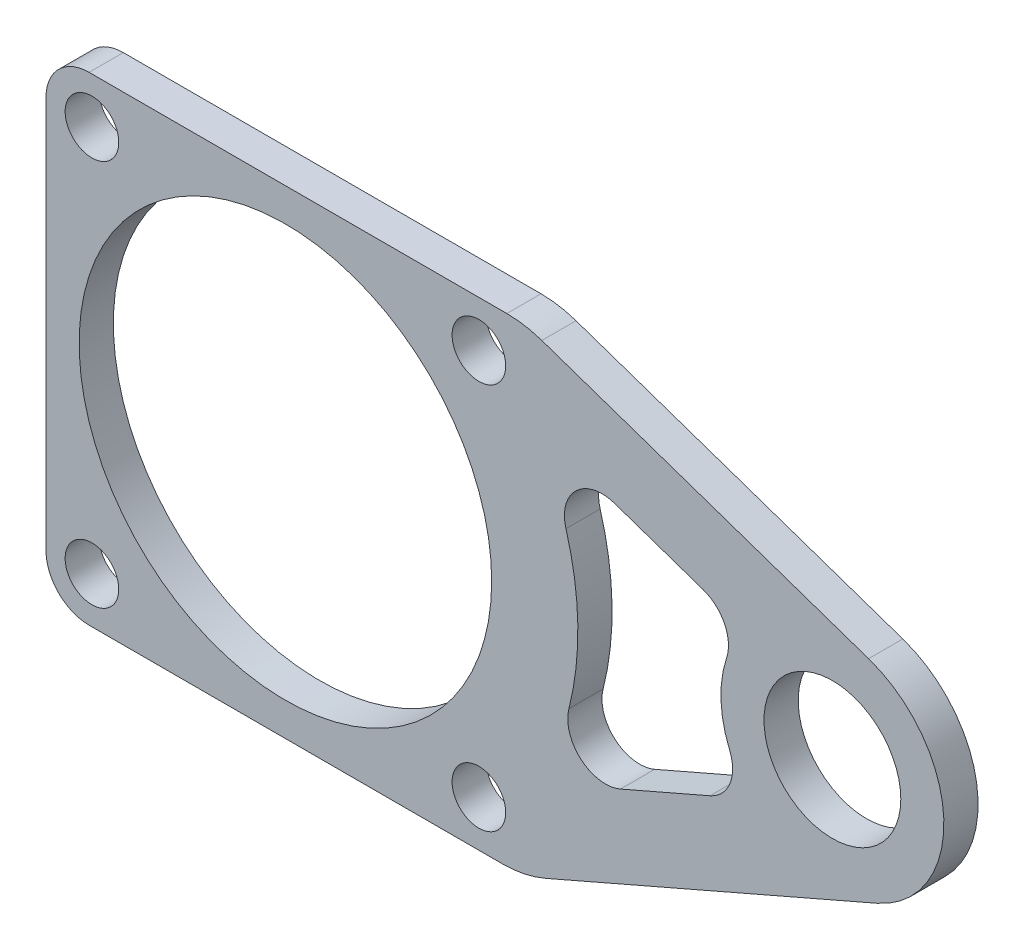
from build123d import *
from OCP.BRepFilletAPI import BRepFilletAPI_MakeFillet

# Parameters (mm, degrees)
SKETCH1_R              = 19.15
SKETCH1_R_2            = 6.35
BOSS_EXTRUDE1_DEPTH    = 3.175
F_10_CLEARANCE_HOLE1_D = 4.9784
FILLET1_R1             = 4
FILLET1_R2             = 10
CUT_EXTRUDE1_DEPTH     = 66.12085781
FILLET2_R              = 3.5


with BuildPart() as part:
    # Sketch1 → Boss-Extrude1 (new body)
    with BuildSketch(Plane.XY):
        with BuildLine():
            Line((54.139758885, 11.266432616), (22.225, 22.225))
            Line((22.225, 22.225), (-22.225, 22.225))
            Line((-22.225, 22.225), (-22.225, -22.225))
            Line((-22.225, -22.225), (22.225, -22.225))
            Line((22.225, -22.225), (54.905795434, -8.01403813))
            ThreePointArc((54.905795434, -8.01403813), (61.120351683, 1.888326902), (54.139758885, 11.266432616))
        make_face()
        Circle(SKETCH1_R, mode=Mode.SUBTRACT)
        with Locations((50.778511122, 1.477433)):
            Circle(SKETCH1_R_2, mode=Mode.SUBTRACT)
    extrude(amount=BOSS_EXTRUDE1_DEPTH)

    # #10 Clearance Hole1 (through all)
    with Locations(Plane.XY.offset(3.175)):
        with Locations((-17.960512242, 17.960512242), (17.960512242, 17.960512242), (17.960512242, -17.960512242), (-17.960512242, -17.960512242)):
            Hole(F_10_CLEARANCE_HOLE1_D / 2)

    # Fillet1: one fillet with a radius per group of edges: ONE call of the kernel's fillet builder (fillet() takes one radius for all edges)
    fillet1_edges_1 = [part.edges().sort_by_distance(p)[0] for p in [
        (-22.225, 22.225, 1.5875),
        (-22.225, -22.225, 1.5875),
    ]]
    fillet1_edges_2 = [part.edges().sort_by_distance(p)[0] for p in [
        (22.225, 22.225, 1.5875),
        (22.225, -22.225, 1.5875),
    ]]
    fillet1 = BRepFilletAPI_MakeFillet(part.part.solid().wrapped)
    for e in fillet1_edges_1:
        fillet1.Add(FILLET1_R1, e.wrapped)
    for e in fillet1_edges_2:
        fillet1.Add(FILLET1_R2, e.wrapped)
    add(Compound.cast(fillet1.Shape()), mode=Mode.REPLACE)

    # Sketch5 → Cut-Extrude1 (cut, through all)
    with BuildSketch(Plane.XY.offset(3.175)):
        with BuildLine():
            ThreePointArc((27.15, 0), (26.129764539, -7.37278137), (23.145734428, -14.191457916))
            Line((23.145734428, -14.191457916), (43.133854728, -5.499796294))
            ThreePointArc((43.133854728, -5.499796294), (40.43667056, 1.066539098), (42.604398146, 7.82616335))
            Line((42.604398146, 7.82616335), (22.893969402, 14.594131184))
            ThreePointArc((22.893969402, 14.594131184), (26.064283697, 7.601027257), (27.15, 0))
        make_face()
    extrude(amount=-CUT_EXTRUDE1_DEPTH, mode=Mode.SUBTRACT)

    # Fillet2
    fillet2_edges = [part.edges().sort_by_distance(p)[0] for p in [
        (43.133854728, -5.499796294, 1.5875),
        (23.145734428, -14.191457916, 1.5875),
        (42.604398146, 7.82616335, 1.5875),
        (22.893969402, 14.594131184, 1.5875),
    ]]
    fillet(fillet2_edges, radius=FILLET2_R)


solid = part.part
